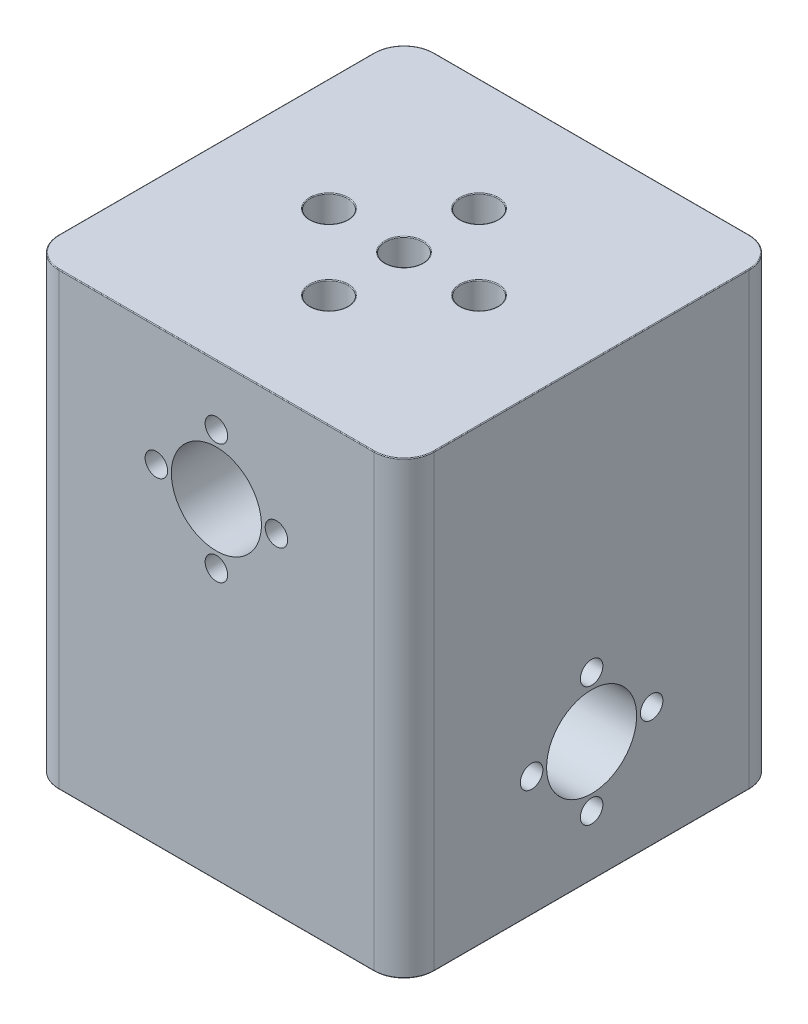
from build123d import *

# Parameters (mm, degrees)
SKETCH1_W           = 50
SKETCH1_H           = 50
BOSS_EXTRUDE1_DEPTH = 60
SKETCH2_R           = 2.5
CUT_EXTRUDE1_DEPTH  = 15
CUT_EXTRUDE6_START  = -15
SKETCH9_R           = 2.5
CUT_EXTRUDE6_DEPTH  = 15
CUT_EXTRUDE2_REACH  = 84.006
SKETCH4_R           = 6
SKETCH10_R          = 6
CUT_EXTRUDE7_DEPTH  = 83.006097365
SKETCH5_R           = 1.5
CUT_EXTRUDE3_DEPTH  = 10
SKETCH11_R          = 1.5
CUT_EXTRUDE8_DEPTH  = 10
CUT_EXTRUDE4_START  = -10
SKETCH6_R           = 1.5
CUT_EXTRUDE4_DEPTH  = 10
CUT_EXTRUDE9_START  = -10
SKETCH12_R          = 1.5
CUT_EXTRUDE9_DEPTH  = 10
FILLET1_R           = 4
FILLET2_R           = 0.1


with BuildPart() as part:
    # Sketch1 → Boss-Extrude1 (new body)
    with BuildSketch(Plane(origin=(0, 0, 0), x_dir=(1, 0, 0), z_dir=(0, 1, 0))):
        Rectangle(SKETCH1_W, SKETCH1_H)
    extrude(amount=BOSS_EXTRUDE1_DEPTH)

    # Sketch2 → Cut-Extrude1 (cut)
    with BuildSketch(Plane.XZ):
        with Locations(Location((0, 10, 0), (0, 0, 270))):
            Circle(SKETCH2_R)
        with Locations(Location((0, -10, 0), (0, 0, 270))):
            Circle(SKETCH2_R)
        with Locations(Location((10, 0, 0), (0, 0, 270))):
            Circle(SKETCH2_R)
        with Locations(Location((-10, 0, 0), (0, 0, 270))):
            Circle(SKETCH2_R)
        with Locations(Location((0, 0, 0), (0, 0, 270))):
            Circle(SKETCH2_R)
    extrude(amount=-CUT_EXTRUDE1_DEPTH, mode=Mode.SUBTRACT)

    # Sketch9 → Cut-Extrude6 (cut)
    with BuildSketch(Plane(origin=(0, 60, 0), x_dir=(1, 0, 0), z_dir=(0, 1, 0)).offset(CUT_EXTRUDE6_START)):
        with Locations(Location((0, 10, 0), (0, 0, 90))):
            Circle(SKETCH9_R)
        with Locations(Location((0, -10, 0), (0, 0, 90))):
            Circle(SKETCH9_R)
        with Locations(Location((10, 0, 0), (0, 0, 90))):
            Circle(SKETCH9_R)
        with Locations(Location((-10, 0, 0), (0, 0, 90))):
            Circle(SKETCH9_R)
        with Locations(Location((0, 0, 0), (0, 0, 90))):
            Circle(SKETCH9_R)
    extrude(amount=CUT_EXTRUDE6_DEPTH, mode=Mode.SUBTRACT)

    # Sketch4 → Cut-Extrude2 (cut, up to next)
    with BuildSketch(Plane.ZY.offset(25), mode=Mode.PRIVATE) as cut_extrude2_sk1:
        with Locations((0, 16)):
            Circle(SKETCH4_R)
    cut_extrude2_tool1 = extrude(cut_extrude2_sk1.sketch, amount=-CUT_EXTRUDE2_REACH, mode=Mode.PRIVATE) & part.part
    add(cut_extrude2_tool1.solids().sort_by_distance((-25, 16, 0))[0], mode=Mode.SUBTRACT)

    # Sketch10 → Cut-Extrude7 (cut, through all)
    with BuildSketch(Plane(origin=(0, 0, -25), x_dir=(-1, 0, 0), z_dir=(0, 0, -1))):
        with Locations((0, 44)):
            Circle(SKETCH10_R)
    extrude(amount=-CUT_EXTRUDE7_DEPTH, mode=Mode.SUBTRACT)

    # Sketch5 → Cut-Extrude3 (cut)
    with BuildSketch(Plane.ZY.offset(25)):
        with Locations((-8, 16)):
            Circle(SKETCH5_R)
        with Locations((8, 16)):
            Circle(SKETCH5_R)
        with Locations((0, 8)):
            Circle(SKETCH5_R)
        with Locations((0, 24)):
            Circle(SKETCH5_R)
    extrude(amount=-CUT_EXTRUDE3_DEPTH, mode=Mode.SUBTRACT)

    # Sketch11 → Cut-Extrude8 (cut)
    with BuildSketch(Plane(origin=(0, 0, -25), x_dir=(-1, 0, 0), z_dir=(0, 0, -1))):
        with Locations((-8, 44)):
            Circle(SKETCH11_R)
        with Locations((8, 44)):
            Circle(SKETCH11_R)
        with Locations((0, 36)):
            Circle(SKETCH11_R)
        with Locations((0, 52)):
            Circle(SKETCH11_R)
    extrude(amount=-CUT_EXTRUDE8_DEPTH, mode=Mode.SUBTRACT)

    # Sketch6 → Cut-Extrude4 (cut)
    with BuildSketch(Plane(origin=(25, 0, 0), x_dir=(0, 0, -1), z_dir=(1, 0, 0)).offset(CUT_EXTRUDE4_START)):
        with Locations(Location((-8, 16, 0), (0, 0, 180))):
            Circle(SKETCH6_R)
        with Locations(Location((8, 16, 0), (0, 0, 180))):
            Circle(SKETCH6_R)
        with Locations(Location((0, 24, 0), (0, 0, 180))):
            Circle(SKETCH6_R)
        with Locations(Location((0, 8, 0), (0, 0, 180))):
            Circle(SKETCH6_R)
    extrude(amount=CUT_EXTRUDE4_DEPTH, mode=Mode.SUBTRACT)

    # Sketch12 → Cut-Extrude9 (cut)
    with BuildSketch(Plane.XY.offset(25).offset(CUT_EXTRUDE9_START)):
        with Locations(Location((-8, 44, 0), (0, 0, 180))):
            Circle(SKETCH12_R)
        with Locations(Location((8, 44, 0), (0, 0, 180))):
            Circle(SKETCH12_R)
        with Locations(Location((0, 36, 0), (0, 0, 180))):
            Circle(SKETCH12_R)
        with Locations(Location((0, 52, 0), (0, 0, 180))):
            Circle(SKETCH12_R)
    extrude(amount=CUT_EXTRUDE9_DEPTH, mode=Mode.SUBTRACT)

    # Fillet1
    fillet1_edges = [part.edges().sort_by_distance(p)[0] for p in [
        (25, 30, 25),
        (-25, 30, 25),
        (-25, 30, -25),
        (25, 30, -25),
    ]]
    fillet(fillet1_edges, radius=FILLET1_R)

    # Fillet2
    fillet2_edges = [part.edges().sort_by_distance(p)[0] for p in [
        (25, 0, 0),
        (25, 60, 0),
        (0, 0, 25),
        (-25, 0, 0),
        (0, 0, -25),
        (23.828427125, 0, -23.828427125),
        (-23.828427125, 0, -23.828427125),
        (-23.828427125, 0, 23.828427125),
        (23.828427125, 0, 23.828427125),
        (0, 60, 25),
        (0, 60, -25),
        (-25, 60, 0),
        (23.828427125, 60, -23.828427125),
        (-23.828427125, 60, -23.828427125),
        (-23.828427125, 60, 23.828427125),
        (23.828427125, 60, 23.828427125),
        (0, 0, 12.5),
        (0, 0, 2.5),
        (-10, 0, 2.5),
        (10, 0, 2.5),
        (0, 0, -7.5),
        (0, 60, -7.5),
        (0, 60, 2.5),
        (-10, 60, 2.5),
        (10, 60, 2.5),
        (0, 60, 12.5),
    ]]
    fillet(fillet2_edges, radius=FILLET2_R)


solid = part.part
